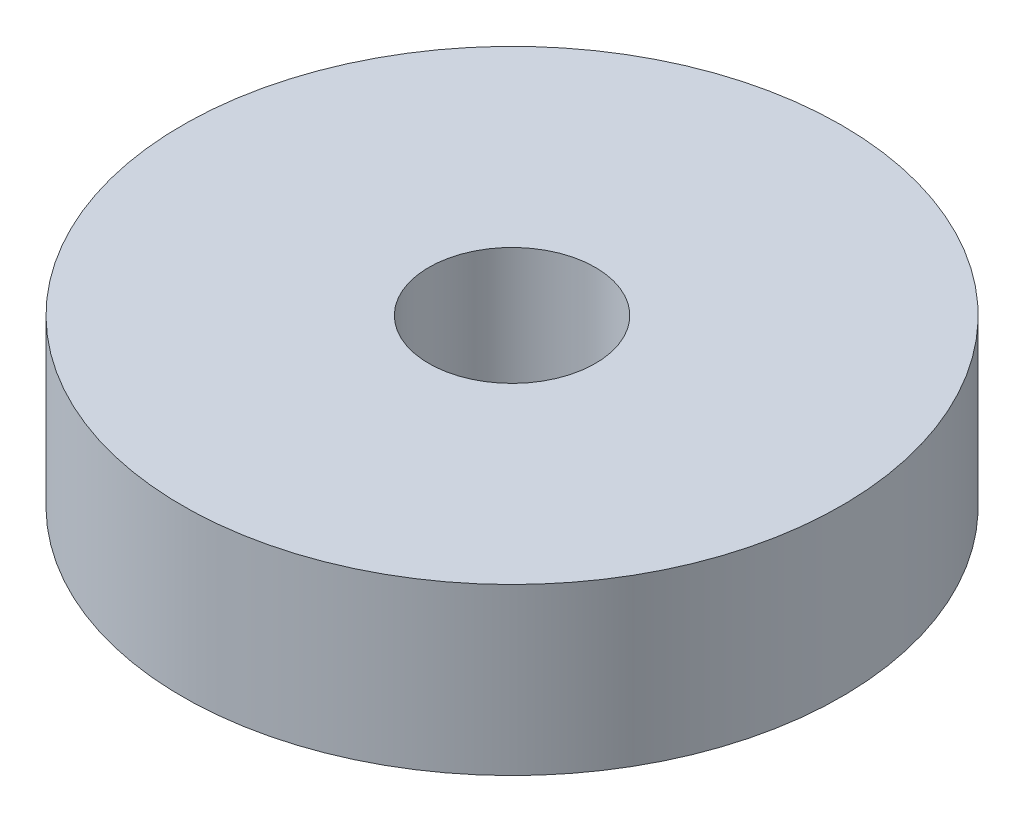
from build123d import *

# Parameters (mm, degrees)
GEAR_SKETCH_W = 8.93
GEAR_SKETCH_H = 6


with BuildPart() as part:
    # Gear Sketch → Gear (revolve)
    with BuildSketch(Plane.XY):
        with Locations((7.485, 61.5)):
            Rectangle(GEAR_SKETCH_W, GEAR_SKETCH_H)
    revolve(axis=Axis((0, -100, 0), (0, 1, 0)))


solid = part.part
